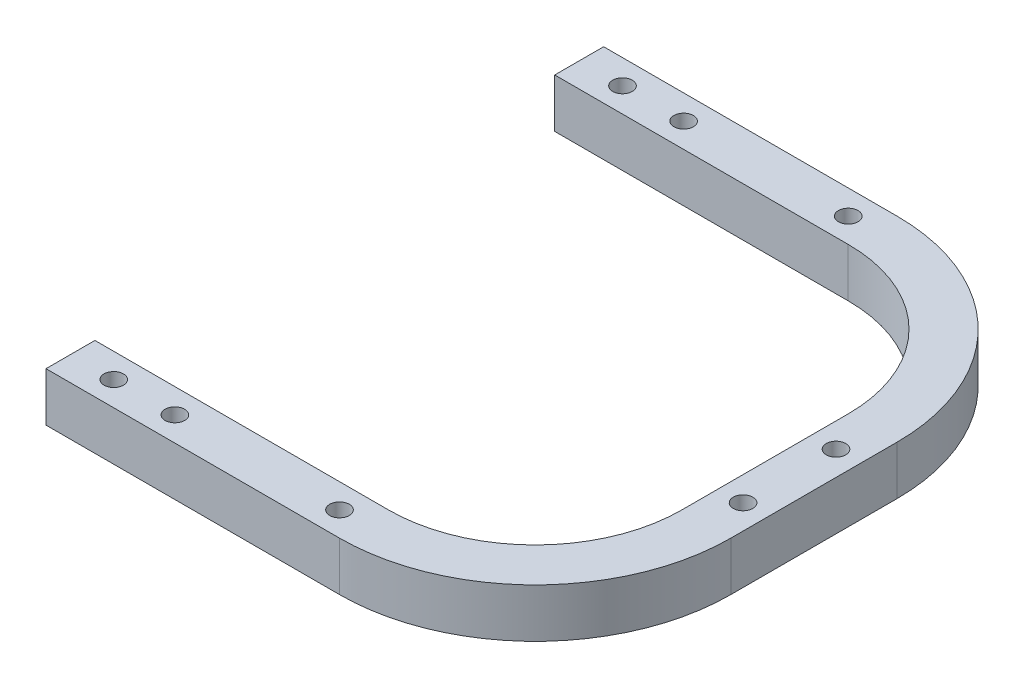
from build123d import *

# Parameters (mm, degrees)
SKETCH1_R           = 2
BOSS_EXTRUDE1_DEPTH = 10


with BuildPart() as part:
    # Sketch1 → Boss-Extrude1 (new body)
    with BuildSketch(Plane(origin=(0, 0, 0), x_dir=(1, 0, 0), z_dir=(0, 1, 0))):
        with BuildLine():
            Line((20, -47), (-40, -47))
            Line((-40, -47), (-40, -57))
            Line((-40, -57), (20, -57))
            ThreePointArc((20, -57), (48.284271247, -45.284271247), (60, -17))
            Line((60, -17), (60, 17))
            ThreePointArc((60, 17), (48.284271247, 45.284271247), (20, 57))
            Line((20, 57), (-40, 57))
            Line((-40, 57), (-40, 47))
            Line((-40, 47), (20, 47))
            ThreePointArc((20, 47), (41.213203436, 38.213203436), (50, 17))
            Line((50, 17), (50, -17))
            ThreePointArc((50, -17), (41.213203436, -38.213203436), (20, -47))
        make_face()
        with Locations(Location((55, 9.5, 0), (0, 0, 270))):
            Circle(SKETCH1_R, mode=Mode.SUBTRACT)
        with Locations(Location((55, -9.5, 0), (0, 0, 270))):
            Circle(SKETCH1_R, mode=Mode.SUBTRACT)
        with Locations(Location((15, 52, 0), (0, 0, 270))):
            Circle(SKETCH1_R, mode=Mode.SUBTRACT)
        with Locations(Location((15, -52, 0), (0, 0, 270))):
            Circle(SKETCH1_R, mode=Mode.SUBTRACT)
        with Locations(Location((-18.651513194, 52, 0), (0, 0, 270))):
            Circle(SKETCH1_R, mode=Mode.SUBTRACT)
        with Locations(Location((-31.151513194, 52, 0), (0, 0, 270))):
            Circle(SKETCH1_R, mode=Mode.SUBTRACT)
        with Locations(Location((-18.651513194, -52, 0), (0, 0, 270))):
            Circle(SKETCH1_R, mode=Mode.SUBTRACT)
        with Locations(Location((-31.151513194, -52, 0), (0, 0, 270))):
            Circle(SKETCH1_R, mode=Mode.SUBTRACT)
    extrude(amount=BOSS_EXTRUDE1_DEPTH)


solid = part.part
